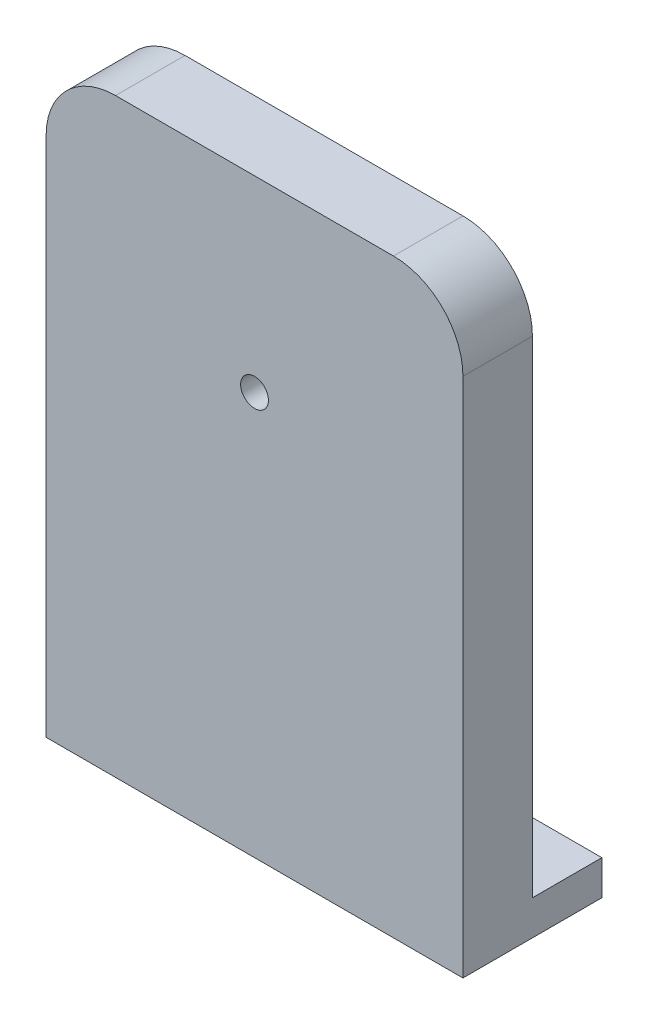
from build123d import *

# Parameters (mm, degrees)
SKETCH1_W           = 60
SKETCH1_H           = 20
BOSS_EXTRUDE1_DEPTH = 5
SKETCH2_W           = 60
SKETCH2_H           = 10
BOSS_EXTRUDE2_DEPTH = 80
SKETCH3_R           = 7.5
CUT_EXTRUDE1_DEPTH  = 5
FILLET1_R           = 10
SKETCH4_R           = 2
CUT_EXTRUDE2_DEPTH  = 92.378334412


with BuildPart() as part:
    # Sketch1 → Boss-Extrude1 (new body)
    with BuildSketch(Plane(origin=(0, 0, 0), x_dir=(1, 0, 0), z_dir=(0, 1, 0))):
        Rectangle(SKETCH1_W, SKETCH1_H)
        with BuildLine():
            Line((-16.8, 8.4), (-5, 8.4))
            ThreePointArc((-5, 8.4), (-1.6, 5), (-5, 1.6))
            Line((-5, 1.6), (-16.8, 1.6))
            ThreePointArc((-16.8, 1.6), (-20.2, 5), (-16.8, 8.4))
        make_face(mode=Mode.SUBTRACT)
        with BuildLine():
            Line((3.2, 8.4), (15, 8.4))
            ThreePointArc((15, 8.4), (18.4, 5), (15, 1.6))
            Line((15, 1.6), (3.2, 1.6))
            ThreePointArc((3.2, 1.6), (-0.2, 5), (3.2, 8.4))
        make_face(mode=Mode.SUBTRACT)
    extrude(amount=BOSS_EXTRUDE1_DEPTH)

    # Sketch2 → Boss-Extrude2 (add)
    with BuildSketch(Plane(origin=(0, 5, 0), x_dir=(1, 0, 0), z_dir=(0, 1, 0))):
        with Locations((0, -5)):
            Rectangle(SKETCH2_W, SKETCH2_H)
    extrude(amount=BOSS_EXTRUDE2_DEPTH)

    # Sketch3 → Cut-Extrude1 (cut)
    with BuildSketch(Plane(origin=(0, 0, 0), x_dir=(-1, 0, 0), z_dir=(0, 0, -1))):
        with Locations((0, 58)):
            Circle(SKETCH3_R)
    extrude(amount=-CUT_EXTRUDE1_DEPTH, mode=Mode.SUBTRACT)

    # Fillet1
    fillet1_edges = [part.edges().sort_by_distance(p)[0] for p in [
        (30, 85, 5),
        (-30, 85, 5),
    ]]
    fillet(fillet1_edges, radius=FILLET1_R)

    # Sketch4 → Cut-Extrude2 (cut, through all)
    with BuildSketch(Plane(origin=(0, 0, 5), x_dir=(-1, 0, 0), z_dir=(0, 0, -1))):
        with Locations((0, 58)):
            Circle(SKETCH4_R)
    extrude(amount=-CUT_EXTRUDE2_DEPTH, mode=Mode.SUBTRACT)


solid = part.part
